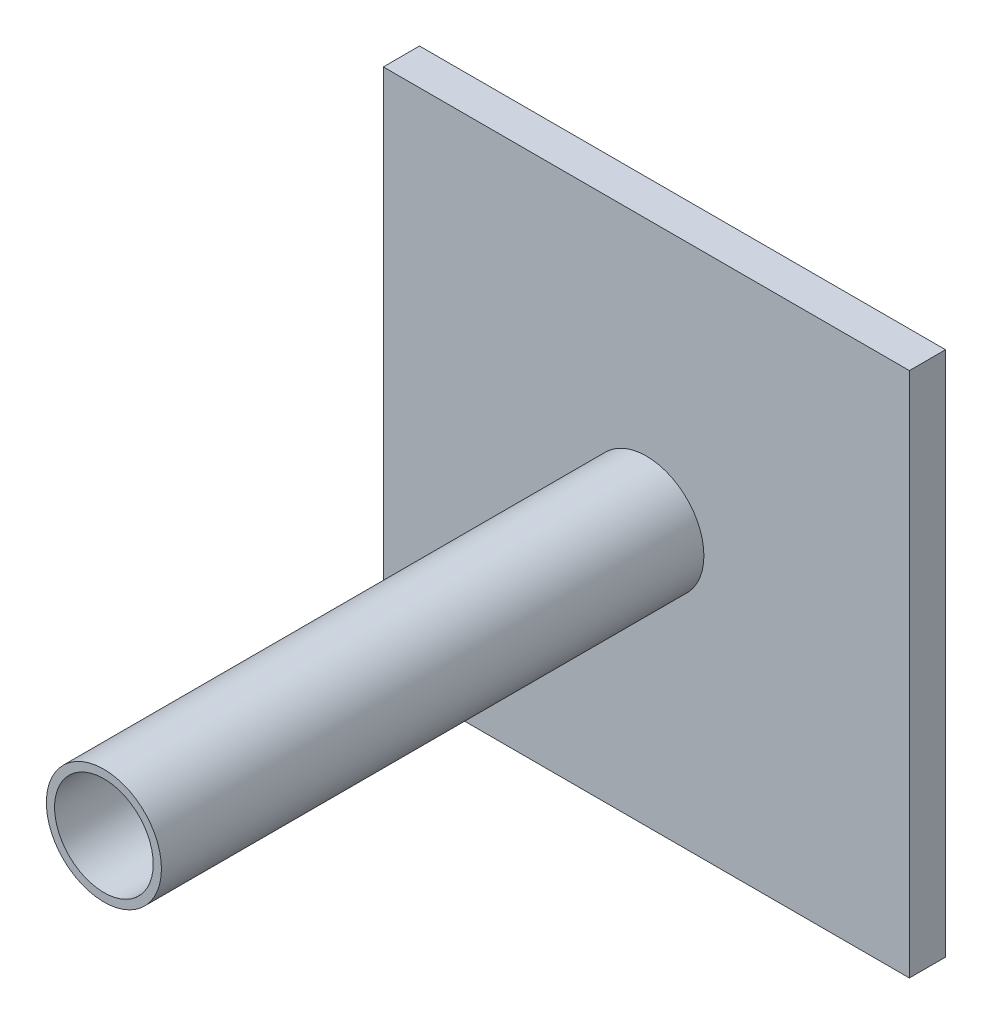
from build123d import *

# Parameters (mm, degrees)
ESQUISSE1_W             = 32
ESQUISSE1_H             = 32
BOSS_EXTRU_1_DEPTH      = 2.2
ESQUISSE2_R             = 3.5
BOSS_EXTRU_2_DEPTH      = 33
ESQUISSE3_R             = 3
ENL_V_MAT_EXTRU_1_DEPTH = 44.447262572


with BuildPart() as part:
    # Esquisse1 → Boss.-Extru.1 (new body)
    with BuildSketch(Plane.XY):
        with Locations((-1.848605578, 2.167330677)):
            Rectangle(ESQUISSE1_W, ESQUISSE1_H)
    extrude(amount=BOSS_EXTRU_1_DEPTH)

    # Esquisse2 → Boss.-Extru.2 (add)
    with BuildSketch(Plane.XY.offset(2.2)):
        with Locations((-1.848605578, 2.167330677)):
            Circle(ESQUISSE2_R)
    extrude(amount=BOSS_EXTRU_2_DEPTH)

    # Esquisse3 → Enlèv. mat.-Extru.1 (cut, through all)
    with BuildSketch(Plane.XY.offset(35.2)):
        with Locations((-1.848605578, 2.167330677)):
            Circle(ESQUISSE3_R)
    extrude(amount=-ENL_V_MAT_EXTRU_1_DEPTH, mode=Mode.SUBTRACT)


solid = part.part
